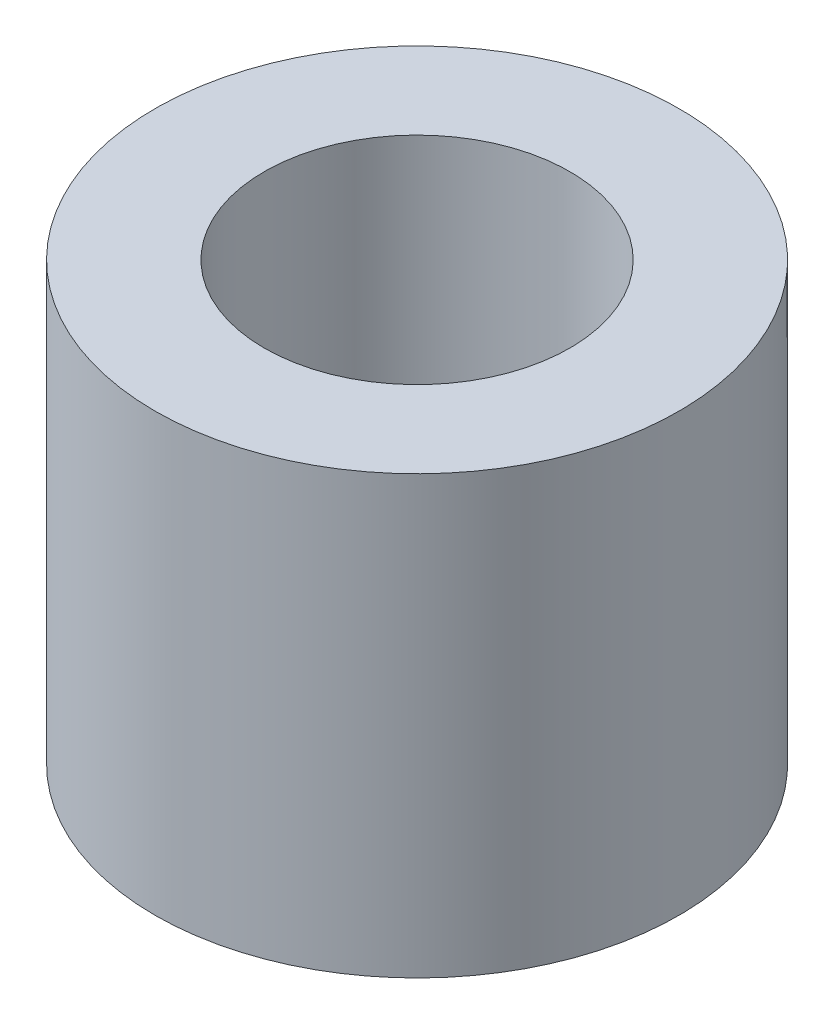
from build123d import *

# Parameters (mm, degrees)
SKETCH_1_R      = 3.6
SKETCH_1_R_2    = 2.1
EXTRUDE_1_DEPTH = 3


with BuildPart() as part:
    # 草图1 → 凸台-拉伸1 (new, symmetric)
    with BuildSketch(Plane(origin=(0, 0, 0), x_dir=(1, 0, 0), z_dir=(0, 1, 0))):
        with Locations(Location((0, 0, 0), (0, 0, 270))):
            Circle(SKETCH_1_R)
        with Locations(Location((0, 0, 0), (0, 0, 270))):
            Circle(SKETCH_1_R_2, mode=Mode.SUBTRACT)
    extrude(amount=EXTRUDE_1_DEPTH, both=True)


solid = part.part
